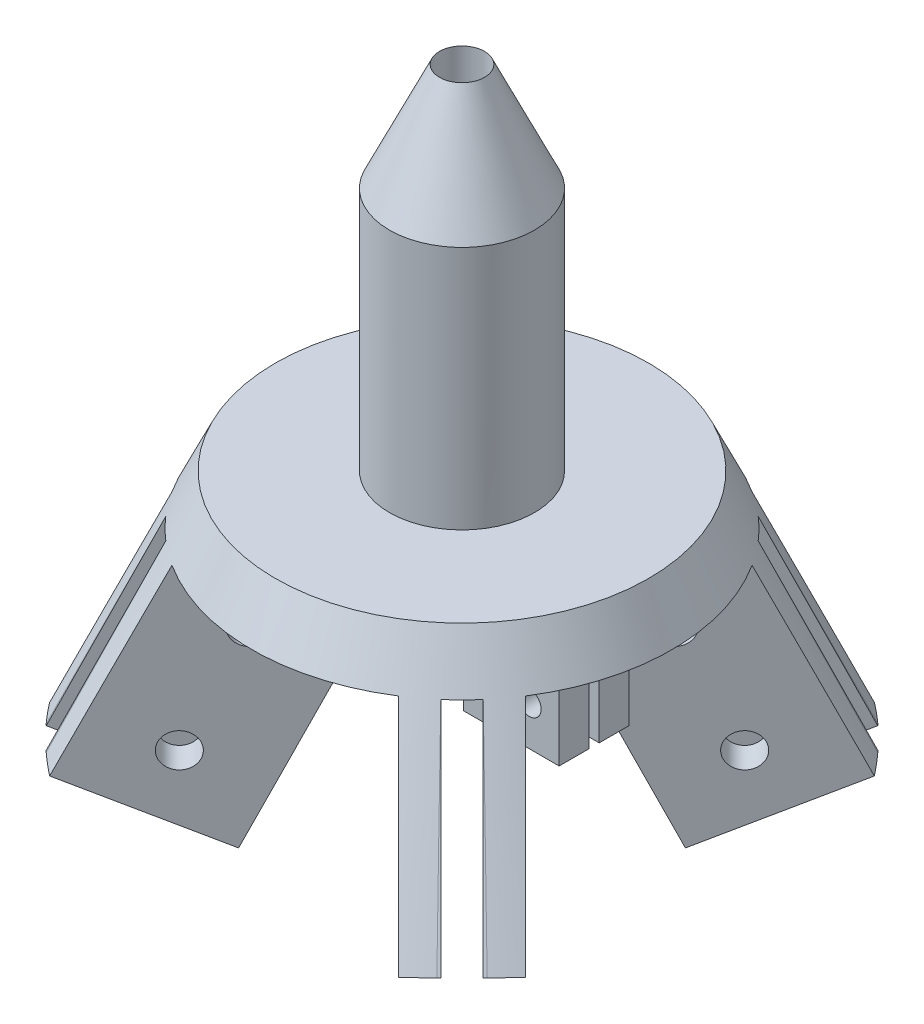
from build123d import *
from build123d.topology import SkipClean

# Parameters (mm, degrees)
SKETCH4_W                       = 9.539179917
SKETCH4_H                       = 12.2
BOSS_EXTRUDE1_DEPTH             = 3
BOSS_EXTRUDE2_DEPTH             = 3
CIRPATTERN2_COUNT               = 4
CIRPATTERN2_COPY_1_DEPTH        = 3
CIRPATTERN2_COPY_2_DEPTH        = 3
CIRPATTERN2_COPY_3_DEPTH        = 3
CUT_EXTRUDE1_REACH              = 56.08
SKETCH8_R                       = 1.2
CUT_EXTRUDE1_DIRECTION_2_DEPTH  = 55.079941432
TAP_DRILL_FOR_M2X0_4_TAP1_D     = 1.6
TAP_DRILL_FOR_M2X0_4_TAP1_DEPTH = 3
M3_CLEARANCE_HOLE1_D            = 3.4
M3_CLEARANCE_HOLE1_DEPTH        = 3
M3_CLEARANCE_HOLE2_D            = 3.4
CIRPATTERN3_COUNT               = 4


with BuildPart() as part:
    # Sketch3 → Revolve1 (revolve)
    with BuildSketch(Plane.XY, mode=Mode.PRIVATE) as revolve1_sk:
        Polygon((2.25, 0), (2.25, 40.174859429), (7.25, 29.452324826), (7.25, 5), (18.652306326, 5), (20.983844617, 0), align=None)
    revolve(revolve1_sk.sketch.rotate(Axis((0, 21.429426471, 0), (0, -1, 0)), 180), axis=Axis((0, 21.429426471, 0), (0, -1, 0)))

    # Sketch4 → Boss-Extrude1 (add)
    with BuildSketch(Plane.XY.offset(0.5)):
        with Locations((8.440410041, -6.1)):
            Rectangle(SKETCH4_W, SKETCH4_H)
    boss_extrude1 = extrude(amount=BOSS_EXTRUDE1_DEPTH)

    # Mirror1: Boss-Extrude1 across plane
    add(boss_extrude1.mirror(Plane.XY))

    # Sketch9 → Boss-Extrude2 (add)
    with BuildSketch(Plane(origin=(-1.060660172, 0, 1.060660172), x_dir=(0, -1, 0), z_dir=(-0.7071067811865488, 0, 0.7071067811865464))):
        Polygon((0, 20.93016328), (18.126155741, 29.382528514), (24.465429667, 15.787911709), (0, 4.379494495), align=None)
    boss_extrude2 = extrude(amount=BOSS_EXTRUDE2_DEPTH)

    # Sketch10 → Cut-Revolve1 (revolve, cut)
    with SkipClean():  # the faces are left unmerged after this step: merging them gives an invalid solid
        with BuildSketch(Plane(origin=(0, 0, 0), x_dir=(-0.7071067811865464, 0, -0.7071067811865488), z_dir=(0.7071067811865488, 0, -0.7071067811865464)), mode=Mode.PRIVATE) as cut_revolve1_sk:
            Polygon((-2.25, 40.174859429), (-32.392261831, -24.465429667), (-32.392261831, 40.174859429), align=None)
        cut_revolve1 = revolve(cut_revolve1_sk.sketch.rotate(Axis((0, 55, 0), (0, -1, 0)), 315), axis=Axis((0, 55, 0), (0, -1, 0)), mode=Mode.SUBTRACT)

    # Mirror2: Boss-Extrude2, Cut-Revolve1 across plane
    with SkipClean():  # the faces are left unmerged after this step: merging them gives an invalid solid
        add(boss_extrude2.mirror(Plane(origin=(0, 0, 0), x_dir=(0.7071067811865465, 0, 0.7071067811865486), z_dir=(-0.7071067811865488, 0, 0.7071067811865464))))
        add(cut_revolve1.mirror(Plane(origin=(0, 0, 0), x_dir=(0.7071067811865465, 0, 0.7071067811865486), z_dir=(-0.7071067811865488, 0, 0.7071067811865464))), mode=Mode.SUBTRACT)

    # CirPattern2: Boss-Extrude2, Cut-Revolve1 ×4 about axis
    with SkipClean():  # the faces are left unmerged after this step: merging them gives an invalid solid
        cirpattern2_axis = Axis((0, 0, 0), (0, 1, 0))
        add([boss_extrude2.rotate(cirpattern2_axis, i * 360 / CIRPATTERN2_COUNT) for i in range(1, CIRPATTERN2_COUNT)])
        add([cut_revolve1.rotate(cirpattern2_axis, i * 360 / CIRPATTERN2_COUNT) for i in range(1, CIRPATTERN2_COUNT)], mode=Mode.SUBTRACT)

    # CirPattern2 copy 1 sketch → CirPattern2 copy 1 (add)
    with SkipClean():  # the faces are left unmerged after this step: merging them gives an invalid solid
        with BuildSketch(Plane(origin=(-1.060660172, 0, -1.060660172), x_dir=(0, -1, 0), z_dir=(-0.7071067811865465, 0, -0.707106781186549))):
            Polygon((0, -20.93016328), (18.126155741, -29.382528514), (24.465429667, -15.787911709), (0, -4.379494495), align=None)
        extrude(amount=CIRPATTERN2_COPY_1_DEPTH)

    # CirPattern2 copy 2 sketch → CirPattern2 copy 2 (add)
    with SkipClean():  # the faces are left unmerged after this step: merging them gives an invalid solid
        with BuildSketch(Plane(origin=(-1.060660172, 0, 1.060660172), x_dir=(0, -1, 0), z_dir=(-0.707106781186549, 0, 0.7071067811865465))):
            Polygon((0, -20.93016328), (18.126155741, -29.382528514), (24.465429667, -15.787911709), (0, -4.379494495), align=None)
        extrude(amount=CIRPATTERN2_COPY_2_DEPTH)

    # CirPattern2 copy 3 sketch → CirPattern2 copy 3 (add)
    with SkipClean():  # the faces are left unmerged after this step: merging them gives an invalid solid
        with BuildSketch(Plane(origin=(1.060660172, 0, 1.060660172), x_dir=(0, -1, 0), z_dir=(0.7071067811865465, 0, 0.7071067811865491))):
            Polygon((0, -20.93016328), (18.126155741, -29.382528514), (24.465429667, -15.787911709), (0, -4.379494495), align=None)
        extrude(amount=CIRPATTERN2_COPY_3_DEPTH)

    # CirPattern2 copy 4 sketch → CirPattern2 copy 4 (revolve, cut)
    with SkipClean():  # the faces are left unmerged after this step: merging them gives an invalid solid
        with BuildSketch(Plane(origin=(0, 0, 0), x_dir=(-0.7071067811865489, 0, 0.7071067811865464), z_dir=(0.7071067811865465, 0, 0.707106781186549))):
            Polygon((-2.25, -40.174859429), (-32.392261831, 24.465429667), (-32.392261831, -40.174859429), align=None)
        revolve(axis=Axis((0, 55, 0), (0, 1, 0)), mode=Mode.SUBTRACT)

    # CirPattern2 copy 5 sketch → CirPattern2 copy 5 (revolve, cut)
    with SkipClean():  # the faces are left unmerged after this step: merging them gives an invalid solid
        with BuildSketch(Plane(origin=(0, 0, 0), x_dir=(0.7071067811865464, 0, 0.7071067811865489), z_dir=(0.707106781186549, 0, -0.7071067811865465))):
            Polygon((-2.25, -40.174859429), (-32.392261831, 24.465429667), (-32.392261831, -40.174859429), align=None)
        revolve(axis=Axis((0, 55, 0), (0, 1, 0)), mode=Mode.SUBTRACT)

    # CirPattern2 copy 6 sketch → CirPattern2 copy 6 (revolve, cut)
    with SkipClean():  # the faces are left unmerged after this step: merging them gives an invalid solid
        with BuildSketch(Plane(origin=(0, 0, 0), x_dir=(0.7071067811865489, 0, -0.7071067811865462), z_dir=(-0.7071067811865465, 0, -0.7071067811865491))):
            Polygon((-2.25, -40.174859429), (-32.392261831, 24.465429667), (-32.392261831, -40.174859429), align=None)
        revolve(axis=Axis((0, 55, 0), (0, 1, 0)), mode=Mode.SUBTRACT)

    # Cut-Extrude1: up to this face of the body (flat: up to its plane)
    cut_extrude1_end = Plane(part.part.faces().sort_by_distance((8.458119385, -6.149603662, 0.5))[0])
    # Sketch8 → Cut-Extrude1 (cut, up to the picked face)
    with BuildSketch(Plane.XY.offset(3.5), mode=Mode.PRIVATE) as cut_extrude1_sk1:
        with Locations((10.21, -8.2)):
            Circle(SKETCH8_R)
    cut_extrude1_tool1 = split(extrude(cut_extrude1_sk1.sketch, amount=-CUT_EXTRUDE1_REACH, mode=Mode.PRIVATE), bisect_by=cut_extrude1_end, keep=Keep.BOTH, mode=Mode.PRIVATE)
    add(cut_extrude1_tool1.solids().sort_by(Axis((10.21, -8.2, 3.5), (0, 0, -1)))[0], mode=Mode.SUBTRACT)

    # Sketch8 → Cut-Extrude1 direction 2 (cut)
    with SkipClean():  # the faces are left unmerged after this step: merging them gives an invalid solid
        with BuildSketch(Plane.XY.offset(3.5)):
            with Locations((10.21, -8.2)):
                Circle(SKETCH8_R)
        extrude(amount=CUT_EXTRUDE1_DIRECTION_2_DEPTH, mode=Mode.SUBTRACT)

    # Tap Drill for M2x0.4 Tap1
    with Locations(Plane.XY.offset(-0.5)):
        with Locations((10.21, -8.2)):
            Hole(TAP_DRILL_FOR_M2X0_4_TAP1_D / 2, depth=TAP_DRILL_FOR_M2X0_4_TAP1_DEPTH)

    # M3 Clearance Hole1
    with Locations(Plane(origin=(-3.181980515, 0, 3.181980515), x_dir=(0.7071067811865465, 0, 0.7071067811865487), z_dir=(-0.7071067811865487, 0, 0.7071067811865465))):
        with Locations((14.998090227, -5.337914013), (19.976310592, -16.013742039)):
            m3_clearance_hole1 = Hole(M3_CLEARANCE_HOLE1_D / 2, depth=M3_CLEARANCE_HOLE1_DEPTH)

    # M3 Clearance Hole2 (through all)
    with Locations(Plane(origin=(1.060660172, 0, -1.060660172), x_dir=(0.7071067811865465, 0, 0.7071067811865487), z_dir=(-0.7071067811865487, 0, 0.7071067811865465))):
        with Locations((19.976310592, -16.013742039), (14.998090227, -5.337914013)):
            m3_clearance_hole2 = Hole(M3_CLEARANCE_HOLE2_D / 2)

    # CirPattern3: M3 Clearance Hole1, M3 Clearance Hole2 ×4 about axis
    with SkipClean():  # the faces are left unmerged after this step: merging them gives an invalid solid
        cirpattern3_axis = Axis((0, 55, 0), (0, -1, 0))
        add([m3_clearance_hole1.rotate(cirpattern3_axis, i * 360 / CIRPATTERN3_COUNT) for i in range(1, CIRPATTERN3_COUNT)], mode=Mode.SUBTRACT)
        add([m3_clearance_hole2.rotate(cirpattern3_axis, i * 360 / CIRPATTERN3_COUNT) for i in range(1, CIRPATTERN3_COUNT)], mode=Mode.SUBTRACT)


solid = part.part
